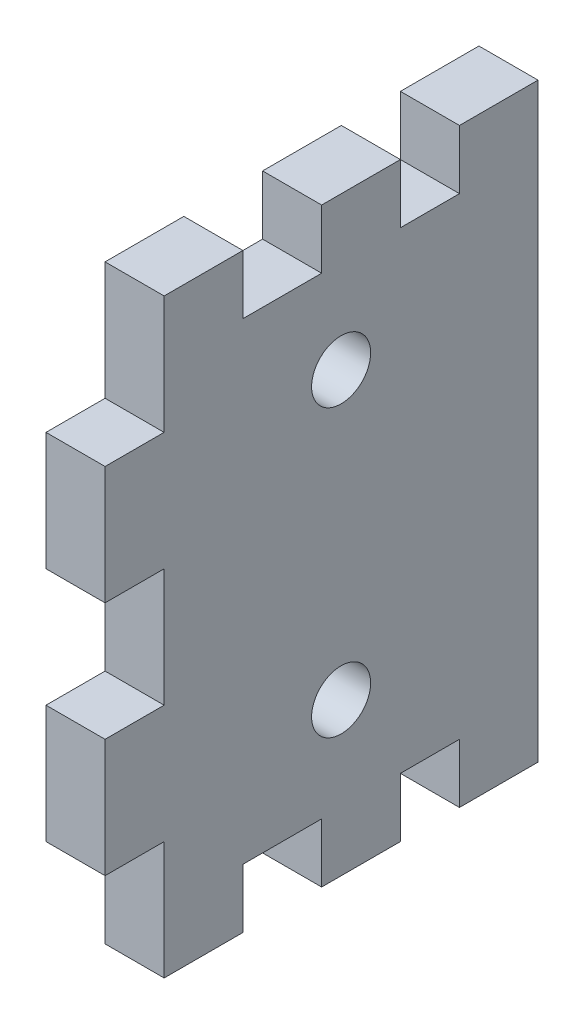
from build123d import *

# Parameters (mm, degrees)
SKETCH1_R           = 1.5
BOSS_EXTRUDE1_DEPTH = 3


with BuildPart() as part:
    # Sketch1 → Boss-Extrude1 (new body)
    with BuildSketch(Plane(origin=(0, 0, 0), x_dir=(0, 0, -1), z_dir=(1, 0, 0))):
        Polygon((0, -29.177050279), (-3.988546489, -29.177050279), (-3.988546489, -26.177050279), (-6.988546489, -26.177050279), (-6.988546489, -29.177050279), (-10.988546489, -29.177050279), (-10.988546489, -26.177050279), (-14.988546489, -26.177050279), (-14.988546489, -29.177050279), (-18.988546489, -29.177050279), (-18.988546489, -23.177050279), (-21.988546489, -23.177050279), (-21.988546489, -17.177050279), (-18.988546489, -17.177050279), (-18.988546489, -11.177050279), (-21.988546489, -11.177050279), (-21.988546489, -5.177050279), (-18.988546489, -5.177050279), (-18.988546489, 0.822949721), (-14.988546489, 0.822949721), (-14.988546489, -2.177050279), (-10.988546489, -2.177050279), (-10.988546489, 0.822949721), (-6.988546489, 0.822949721), (-6.988546489, -2.177050279), (-3.988546489, -2.177050279), (-3.988546489, 0.822949721), (0, 0.822949721), align=None)
        with Locations((-10, -6.917050279)):
            Circle(SKETCH1_R, mode=Mode.SUBTRACT)
        with Locations(Location((-10, -21.437050279, 0), (0, 0, 180))):
            Circle(SKETCH1_R, mode=Mode.SUBTRACT)
    extrude(amount=BOSS_EXTRUDE1_DEPTH)


solid = part.part
